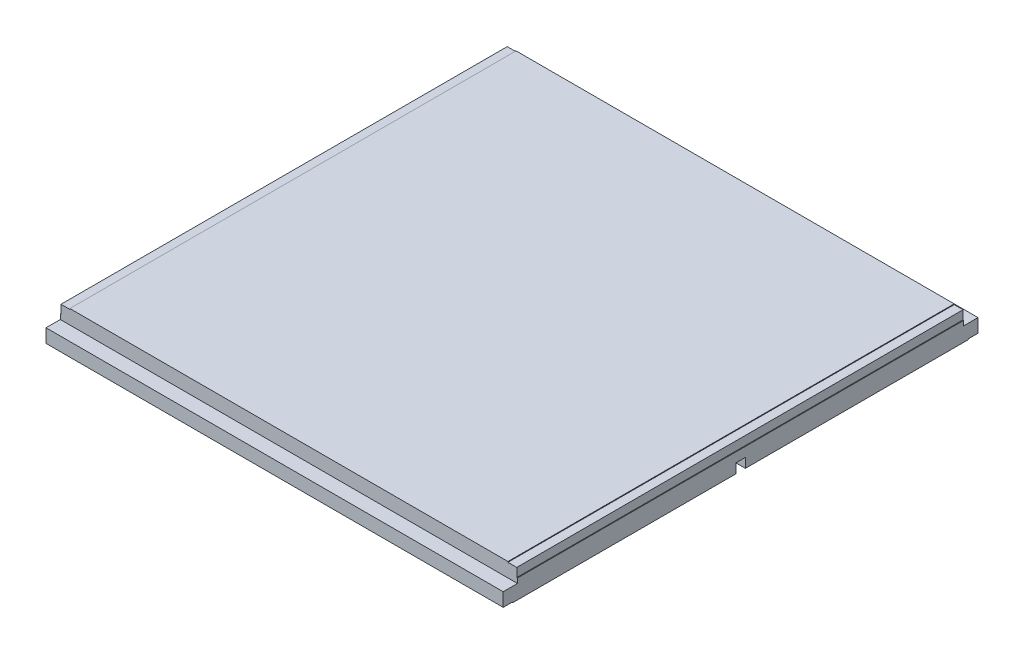
from build123d import *

# Parameters (mm, degrees)
SKETCH1_W           = 1920
SKETCH1_H           = 1994
BOSS_EXTRUDE1_DEPTH = 120
SKETCH2_W           = 60
SKETCH2_H           = 60
CUT_EXTRUDE1_DEPTH  = 2167.750793239
SKETCH3_W           = 40
SKETCH3_H           = 40
CUT_EXTRUDE2_DEPTH  = 2167.750793239
SKETCH4_W           = 1920
SKETCH4_H           = 40
CUT_EXTRUDE3_DEPTH  = 3
SKETCH5_W           = 40
SKETCH5_H           = 1874
CUT_EXTRUDE4_DEPTH  = 3
SKETCH6_W           = 1874
SKETCH6_H           = 40
CUT_EXTRUDE5_DEPTH  = 3


with BuildPart() as part:
    # Sketch1 → Boss-Extrude1 (new body)
    with BuildSketch(Plane(origin=(0, 0, 0), x_dir=(1, 0, 0), z_dir=(0, 1, 0))):
        Rectangle(SKETCH1_W, SKETCH1_H)
    extrude(amount=BOSS_EXTRUDE1_DEPTH)

    # Sketch2 → Cut-Extrude1 (cut, through all)
    with BuildSketch(Plane.ZY.offset(960)):
        with Locations((-967, 90)):
            Rectangle(SKETCH2_W, SKETCH2_H)
        with Locations((967, 90)):
            Rectangle(SKETCH2_W, SKETCH2_H)
    extrude(amount=-CUT_EXTRUDE1_DEPTH, mode=Mode.SUBTRACT)

    # Sketch3 → Cut-Extrude2 (cut, through all)
    with BuildSketch(Plane.ZY.offset(960)):
        with Locations((0, 20)):
            Rectangle(SKETCH3_W, SKETCH3_H)
    extrude(amount=-CUT_EXTRUDE2_DEPTH, mode=Mode.SUBTRACT)

    # Sketch4 → Cut-Extrude3 (cut)
    with BuildSketch(Plane(origin=(0, 0, 0), x_dir=(-1, 0, 0), z_dir=(0, -1, 0))):
        with Locations((0, 977)):
            Rectangle(SKETCH4_W, SKETCH4_H)
        with Locations((0, -977)):
            Rectangle(SKETCH4_W, SKETCH4_H)
    extrude(amount=-CUT_EXTRUDE3_DEPTH, mode=Mode.SUBTRACT)

    # Sketch5 → Cut-Extrude4 (cut)
    with BuildSketch(Plane(origin=(0, 120, 0), x_dir=(1, 0, 0), z_dir=(0, 1, 0))):
        with Locations((-940, 0)):
            Rectangle(SKETCH5_W, SKETCH5_H)
        with Locations((940, 0)):
            Rectangle(SKETCH5_W, SKETCH5_H)
    extrude(amount=-CUT_EXTRUDE4_DEPTH, mode=Mode.SUBTRACT)

    # Sketch6 → Cut-Extrude5 (cut)
    with BuildSketch(Plane.ZY.offset(960)):
        with Locations((0, 100)):
            Rectangle(SKETCH6_W, SKETCH6_H)
    cut_extrude5 = extrude(amount=-CUT_EXTRUDE5_DEPTH, mode=Mode.SUBTRACT)

    # Mirror1: Cut-Extrude5 across plane
    add(cut_extrude5.mirror(Plane(origin=(0, 0, 0), x_dir=(0, 0, 1), z_dir=(1, 0, 0))), mode=Mode.SUBTRACT)


solid = part.part
